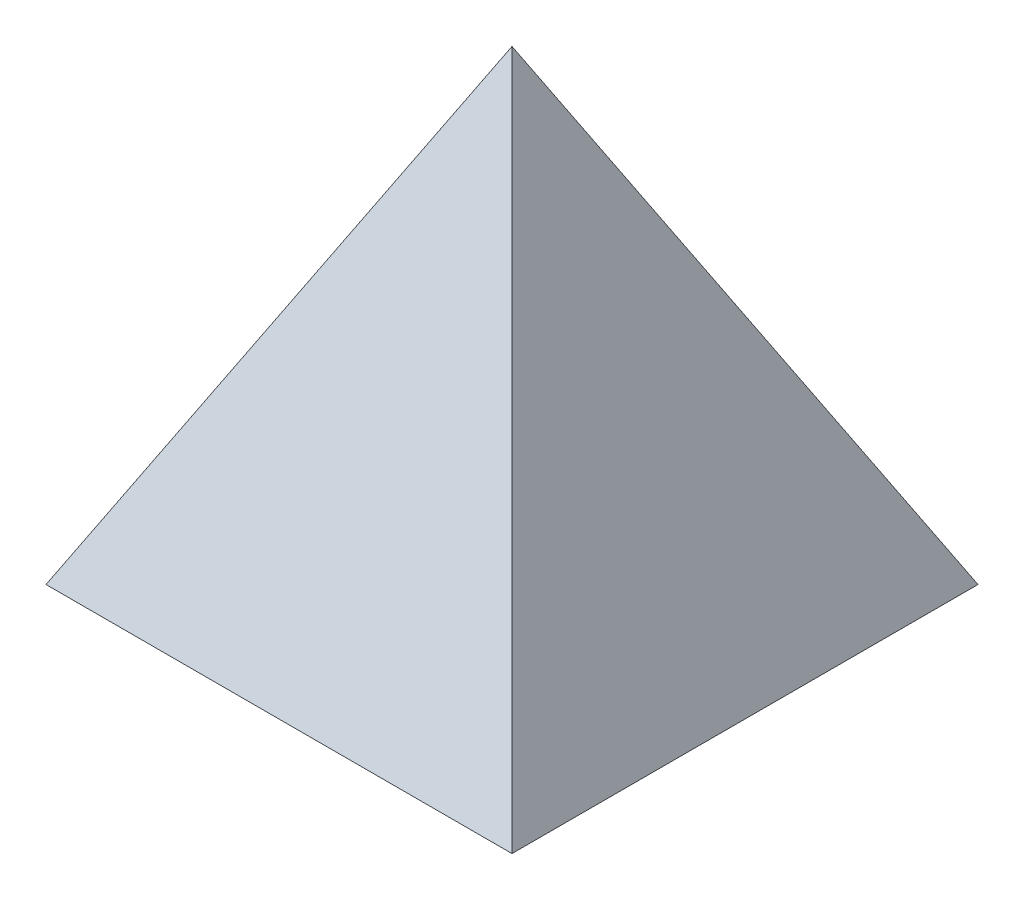
from build123d import *

# Parameters (mm, degrees)
SKETCH1_W           = 50
SKETCH1_H           = 50
BOSS_EXTRUDE1_DEPTH = 50
SKETCH4_OUTSIDE_W   = 69.32
SKETCH4_OUTSIDE_H   = 69.32
CUT_EXTRUDE3_DEPTH  = 62.23724357
SKETCH5_OUTSIDE_W   = 69.32
SKETCH5_OUTSIDE_H   = 69.32
CUT_EXTRUDE4_DEPTH  = 62.23724357
SKETCH6_OUTSIDE_W   = 69.32
SKETCH6_OUTSIDE_H   = 69.32
CUT_EXTRUDE5_DEPTH  = 62.23724357
SKETCH7_OUTSIDE_W   = 69.32
SKETCH7_OUTSIDE_H   = 69.32
CUT_EXTRUDE6_DEPTH  = 62.23724357


with BuildPart() as part:
    # Sketch1 → Boss-Extrude1 (new body)
    with BuildSketch(Plane(origin=(0, 0, 0), x_dir=(1, 0, 0), z_dir=(0, 1, 0))):
        Rectangle(SKETCH1_W, SKETCH1_H)
    extrude(amount=BOSS_EXTRUDE1_DEPTH)

    # Sketch4 outside → Cut-Extrude3 (cut, through all)
    with BuildSketch(Plane(origin=(0, 0, 0), x_dir=(0, 0, -1), z_dir=(1, 0, 0))):
        with Locations((0, 25)):
            Rectangle(SKETCH4_OUTSIDE_W, SKETCH4_OUTSIDE_H)
        Polygon((-25, 0), (0, 50), (25, 0), align=None, mode=Mode.SUBTRACT)
    extrude(amount=-CUT_EXTRUDE3_DEPTH, mode=Mode.SUBTRACT)

    # Sketch5 outside → Cut-Extrude4 (cut, through all)
    with BuildSketch(Plane(origin=(0, 0, 0), x_dir=(0, 0, -1), z_dir=(1, 0, 0))):
        with Locations((0, 25)):
            Rectangle(SKETCH5_OUTSIDE_W, SKETCH5_OUTSIDE_H)
        Polygon((-25, 0), (0, 50), (25, 0), align=None, mode=Mode.SUBTRACT)
    extrude(amount=CUT_EXTRUDE4_DEPTH, mode=Mode.SUBTRACT)

    # Sketch6 outside → Cut-Extrude5 (cut, through all)
    with BuildSketch(Plane.XY):
        with Locations((0, 25)):
            Rectangle(SKETCH6_OUTSIDE_W, SKETCH6_OUTSIDE_H)
        Polygon((-25, 0), (0, 50), (25, 0), align=None, mode=Mode.SUBTRACT)
    extrude(amount=-CUT_EXTRUDE5_DEPTH, mode=Mode.SUBTRACT)

    # Sketch7 outside → Cut-Extrude6 (cut, through all)
    with BuildSketch(Plane.XY):
        with Locations((0, 25)):
            Rectangle(SKETCH7_OUTSIDE_W, SKETCH7_OUTSIDE_H)
        Polygon((-25, 0), (0, 50), (25, 0), align=None, mode=Mode.SUBTRACT)
    extrude(amount=CUT_EXTRUDE6_DEPTH, mode=Mode.SUBTRACT)


solid = part.part
